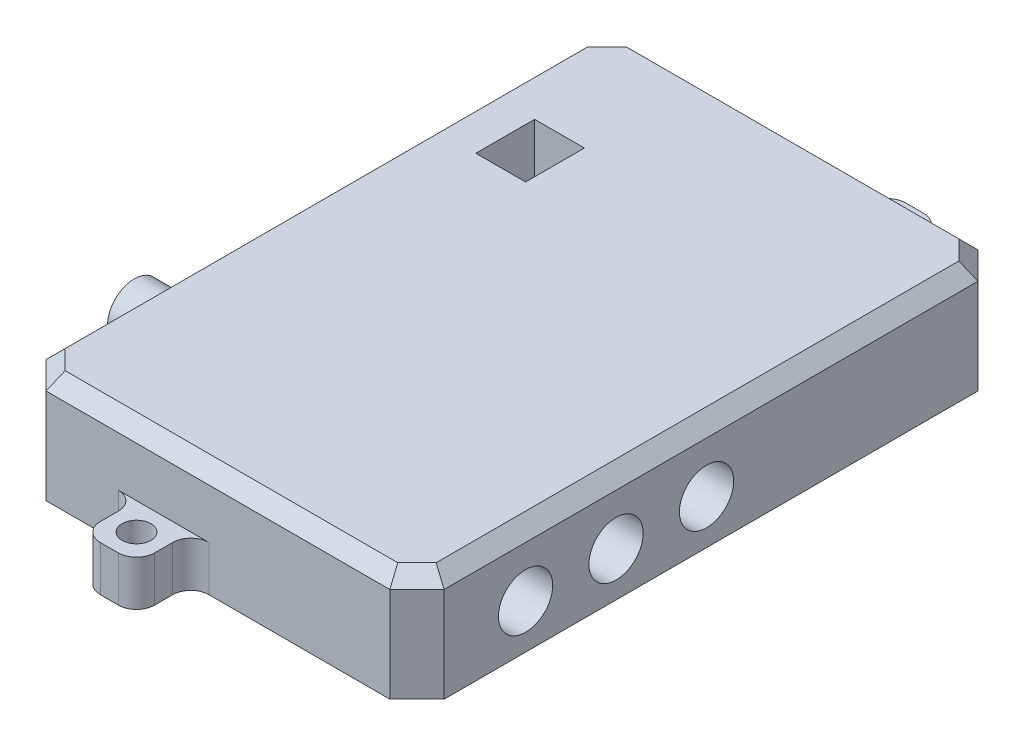
from build123d import *

# Parameters (mm, degrees)
SKETCH_1_W          = 44
SKETCH_1_H          = 65
EXTRUDE_1_DEPTH     = 12
CHAMFER_1_SIZE      = 3
CHAMFER_2_SIZE      = 1.5
SKETCH_2_W          = 6
SKETCH_2_H          = 6
SKETCH_2_R          = 1.6
EXTRUDE_2_DEPTH     = 5
FILLET_1_R          = 2
FILLET_2_R          = 2
SKETCH_3_R          = 3
CUT_EXTRUDE_1_DEPTH = 5
SKETCH_4_R          = 2.96404504
EXTRUDE_3_DEPTH     = 5
SKETCH_5_W          = 5.5
SKETCH_5_H          = 6.5
CUT_EXTRUDE_2_DEPTH = 49.53091798


with BuildPart() as part:
    # 草图1 → 凸台-拉伸1 (new body)
    with BuildSketch(Plane(origin=(0, 0, 0), x_dir=(1, 0, 0), z_dir=(0, 1, 0))):
        Rectangle(SKETCH_1_W, SKETCH_1_H)
    extrude(amount=EXTRUDE_1_DEPTH)

    # 倒角1
    chamfer_1_edges = [part.edges().sort_by_distance(p)[0] for p in [
        (22, 6, 32.5),
        (-22, 6, 32.5),
        (-22, 6, -32.5),
        (22, 6, -32.5),
    ]]
    chamfer(chamfer_1_edges, length=CHAMFER_1_SIZE)

    # 倒角2
    chamfer_2_edges = [part.edges().sort_by_distance(p)[0] for p in [
        (-22, 12, 0),
        (0, 12, -32.5),
        (22, 12, 0),
        (0, 12, 32.5),
        (-20.5, 12, 31),
        (20.5, 12, 31),
        (20.5, 12, -31),
        (-20.5, 12, -31),
    ]]
    chamfer(chamfer_2_edges, length=CHAMFER_2_SIZE)

    # 草图2 → 凸台-拉伸2 (add)
    # profile 1 of 2: a face of its own
    with BuildSketch(Plane.XZ):
        with Locations((-6, 35.5)):
            Rectangle(SKETCH_2_W, SKETCH_2_H)
        with Locations(Location((-6, 35.5, 0), (0, 0, 270))):
            Circle(SKETCH_2_R, mode=Mode.SUBTRACT)
    # profile 2 of 2: a face of its own
    with BuildSketch(Plane.XZ):
        with Locations((6, -35.5)):
            Rectangle(SKETCH_2_W, SKETCH_2_H)
        with Locations(Location((6, -35.5, 0), (0, 0, 270))):
            Circle(SKETCH_2_R, mode=Mode.SUBTRACT)
    extrude(amount=-EXTRUDE_2_DEPTH)

    # 圆角1
    fillet_1_edges = [part.edges().sort_by_distance(p)[0] for p in [
        (9, 2.5, -32.5),
        (3, 2.5, -32.5),
        (-3, 2.5, 32.5),
        (-9, 2.5, 32.5),
    ]]
    fillet(fillet_1_edges, radius=FILLET_1_R)

    # 圆角2
    fillet_2_edges = [part.edges().sort_by_distance(p)[0] for p in [
        (9, 2.5, -38.5),
        (3, 2.5, -38.5),
        (-3, 2.5, 38.5),
        (-9, 2.5, 38.5),
    ]]
    fillet(fillet_2_edges, radius=FILLET_2_R)

    # 草图3 → 切除-拉伸1 (cut)
    with BuildSketch(Plane(origin=(22, 0, 0), x_dir=(0, 0, -1), z_dir=(1, 0, 0))):
        with Locations((-20.5, 4.900714175)):
            Circle(SKETCH_3_R)
        with Locations((-10.5, 4.900714175)):
            Circle(SKETCH_3_R)
        with Locations((-0.5, 4.900714175)):
            Circle(SKETCH_3_R)
    extrude(amount=-CUT_EXTRUDE_1_DEPTH, mode=Mode.SUBTRACT)

    # 草图4 → 凸台-拉伸3 (add)
    with BuildSketch(Plane.ZY.offset(22)):
        with Locations(Location((14.738572915, 5.389285653, 0), (0, 0, 180))):
            Circle(SKETCH_4_R)
    extrude(amount=EXTRUDE_3_DEPTH)

    # 草图5 → 切除-拉伸2 (cut, through all)
    with BuildSketch(Plane.XZ):
        with Locations((-13.75, -15.75)):
            Rectangle(SKETCH_5_W, SKETCH_5_H)
    extrude(amount=-CUT_EXTRUDE_2_DEPTH, mode=Mode.SUBTRACT)


solid = part.part
